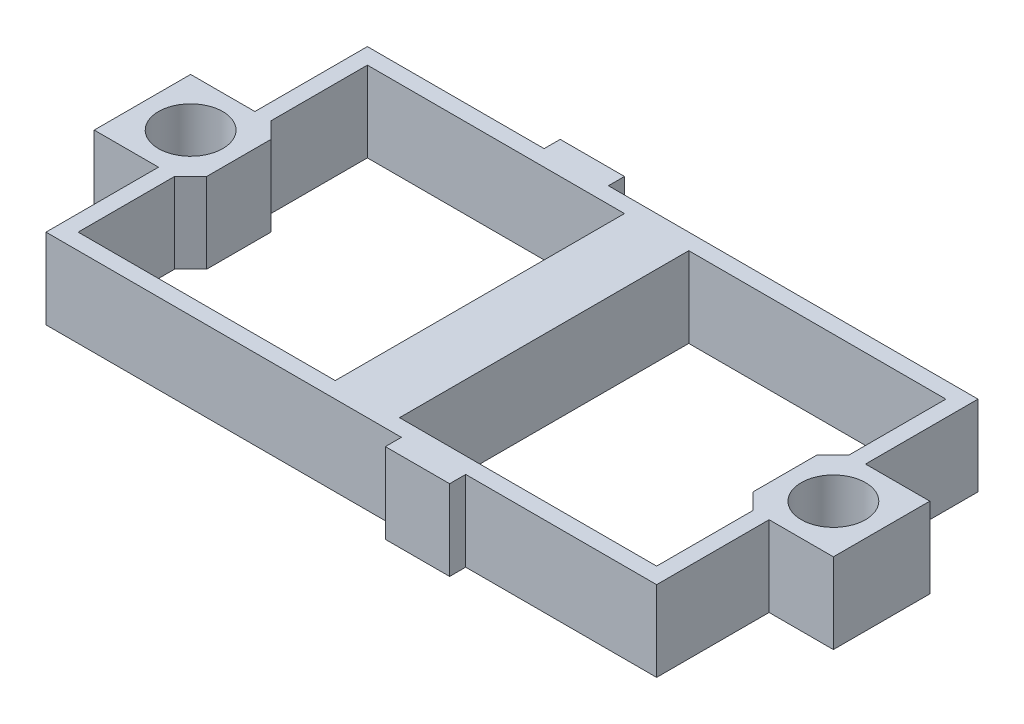
from build123d import *

# Parameters (mm, degrees)
SKETCH1_R           = 12.7
BOSS_EXTRUDE2_DEPTH = 31.75


with BuildPart() as part:
    # Sketch1 → Boss-Extrude2 (new body)
    with BuildSketch(Plane(origin=(0, 0, 0), x_dir=(1, 0, 0), z_dir=(0, 1, 0))):
        Polygon((95.25, 127), (241.3, 127), (241.3, 82.55), (266.7, 82.55), (266.7, 44.45), (241.3, 44.45), (241.3, 0), (165.851748879, 0), (165.851748879, -6.35), (140.451748879, -6.35), (140.451748879, 0), (0, 0), (0, 44.45), (-25.4, 44.45), (-25.4, 82.55), (0, 82.55), (0, 127), (69.85, 127), (69.85, 133.35), (95.25, 133.35), align=None)
        with Locations(Location((247.65, 63.5, 0), (0, 0, 270))):
            Circle(SKETCH1_R, mode=Mode.SUBTRACT)
        with Locations(Location((-6.35, 63.5, 0), (0, 0, 270))):
            Circle(SKETCH1_R, mode=Mode.SUBTRACT)
        Polygon((6.35, 82.55), (12.7, 76.2), (12.7, 50.8), (6.35, 44.45), (6.35, 6.35), (107.95, 6.35), (107.95, 120.65), (6.35, 120.65), align=None, mode=Mode.SUBTRACT)
        Polygon((234.95, 82.55), (228.6, 76.2), (228.6, 50.8), (234.95, 44.45), (234.95, 6.35), (133.35, 6.35), (133.35, 120.65), (234.95, 120.65), align=None, mode=Mode.SUBTRACT)
    extrude(amount=BOSS_EXTRUDE2_DEPTH)


solid = part.part
